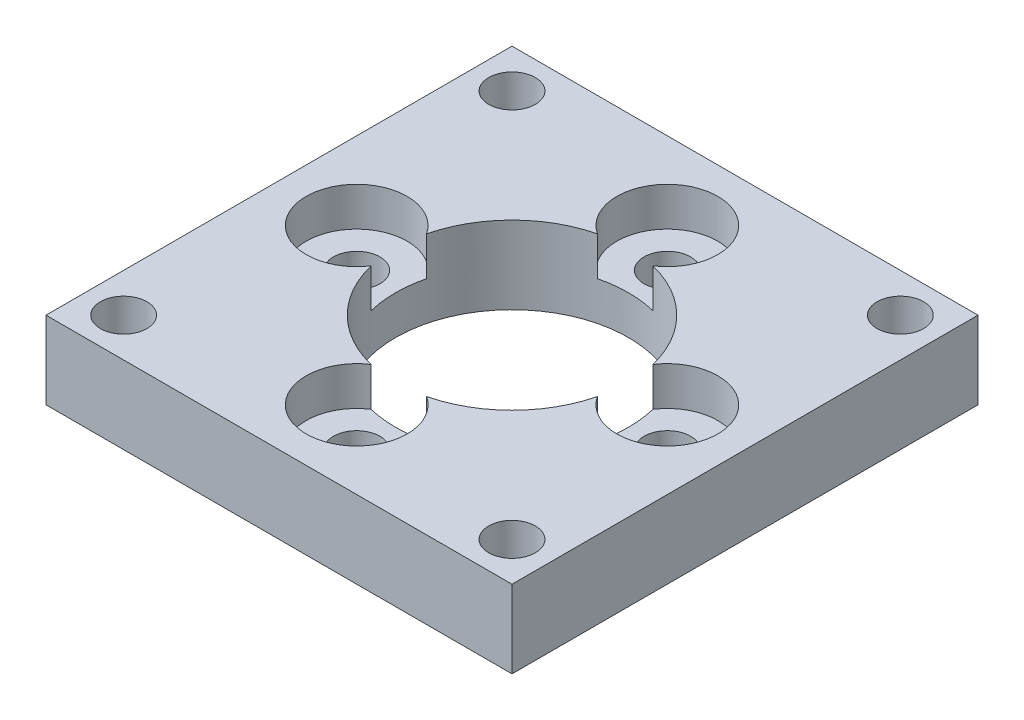
from build123d import *

# Parameters (mm, degrees)
SKETCH1_W           = 60
SKETCH1_H           = 60
SKETCH1_R           = 15
BOSS_EXTRUDE1_DEPTH = 10
SKETCH2_R           = 3
CUT_EXTRUDE1_DEPTH  = 10
SKETCH3_R           = 6.5
CUT_EXTRUDE2_DEPTH  = 5
SKETCH4_R           = 3
CUT_EXTRUDE3_DEPTH  = 10


with BuildPart() as part:
    # Sketch1 → Boss-Extrude1 (new body)
    with BuildSketch(Plane(origin=(0, 0, 0), x_dir=(1, 0, 0), z_dir=(0, 1, 0))):
        with Locations((30, 30)):
            Rectangle(SKETCH1_W, SKETCH1_H)
        with Locations(Location((30, 30, 0), (0, 0, 270))):
            Circle(SKETCH1_R, mode=Mode.SUBTRACT)
    extrude(amount=BOSS_EXTRUDE1_DEPTH)

    # Sketch2 → Cut-Extrude1 (cut)
    with BuildSketch(Plane(origin=(0, 10, 0), x_dir=(1, 0, 0), z_dir=(0, 1, 0))):
        with Locations(Location((30, 50, 0), (0, 0, 270))):
            Circle(SKETCH2_R)
        with Locations(Location((50, 30, 0), (0, 0, 270))):
            Circle(SKETCH2_R)
        with Locations(Location((30, 10, 0), (0, 0, 270))):
            Circle(SKETCH2_R)
        with Locations(Location((10, 30, 0), (0, 0, 270))):
            Circle(SKETCH2_R)
    extrude(amount=-CUT_EXTRUDE1_DEPTH, mode=Mode.SUBTRACT)

    # Sketch3 → Cut-Extrude2 (cut)
    with BuildSketch(Plane(origin=(0, 10, 0), x_dir=(1, 0, 0), z_dir=(0, 1, 0))):
        with Locations((30, 50)):
            Circle(SKETCH3_R)
        with Locations((50, 30)):
            Circle(SKETCH3_R)
        with Locations((30, 10)):
            Circle(SKETCH3_R)
        with Locations((10, 30)):
            Circle(SKETCH3_R)
    extrude(amount=-CUT_EXTRUDE2_DEPTH, mode=Mode.SUBTRACT)

    # Sketch4 → Cut-Extrude3 (cut)
    with BuildSketch(Plane.XZ):
        with Locations(Location((5, -5, 0), (0, 0, 270))):
            Circle(SKETCH4_R)
        with Locations(Location((55, -5, 0), (0, 0, 270))):
            Circle(SKETCH4_R)
        with Locations(Location((55, -55, 0), (0, 0, 270))):
            Circle(SKETCH4_R)
        with Locations(Location((5, -55, 0), (0, 0, 270))):
            Circle(SKETCH4_R)
    extrude(amount=-CUT_EXTRUDE3_DEPTH, mode=Mode.SUBTRACT)


solid = part.part
